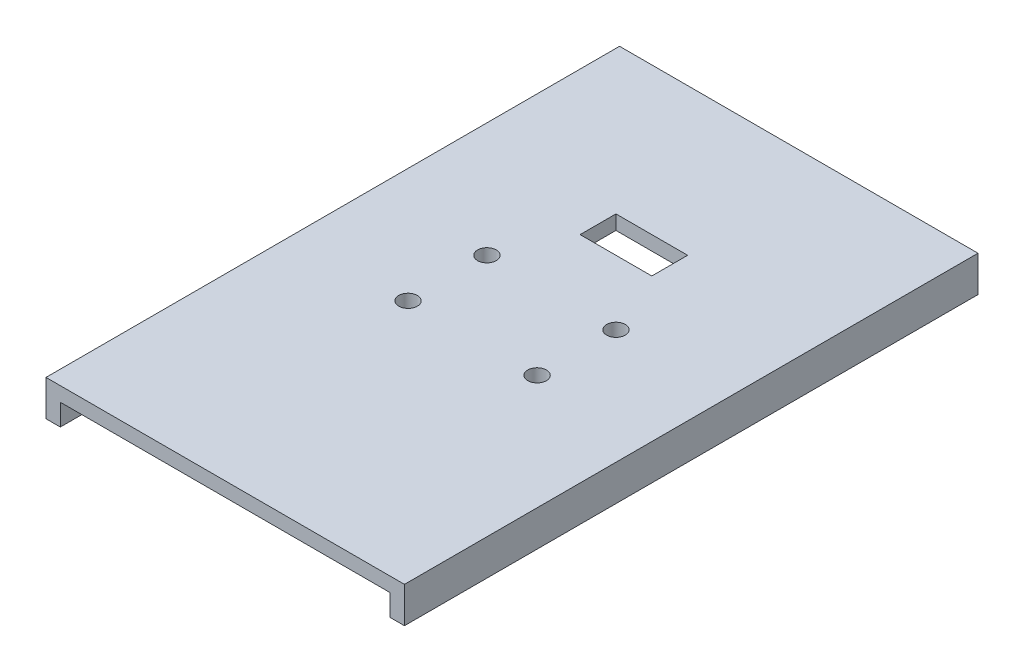
from build123d import *

# Parameters (mm, degrees)
SKETCH1_W           = 40
SKETCH1_H           = 80
BOSS_EXTRUDE1_DEPTH = 2
BOSS_EXTRUDE2_DEPTH = 80
SKETCH3_R           = 1.3
SKETCH3_W           = 10
SKETCH3_H           = 5
CUT_EXTRUDE1_DEPTH  = 2


with BuildPart() as part:
    # Sketch1 → Boss-Extrude1 (new body)
    with BuildSketch(Plane(origin=(0, 0, 0), x_dir=(1, 0, 0), z_dir=(0, 1, 0))):
        with Locations((20, 40)):
            Rectangle(SKETCH1_W, SKETCH1_H)
    extrude(amount=BOSS_EXTRUDE1_DEPTH)

    # Sketch2 → Boss-Extrude2 (add)
    with BuildSketch(Plane.XY):
        Polygon((0, 2), (-5, 2), (-5, -3), (-3, -3), (-3, 0), (0, 0), align=None)
        Polygon((43, 0), (40, 0), (40, 2), (45, 2), (45, -3), (43, -3), align=None)
    extrude(amount=-BOSS_EXTRUDE2_DEPTH)

    # Sketch3 → Cut-Extrude1 (cut)
    with BuildSketch(Plane(origin=(0, 2, 0), x_dir=(1, 0, 0), z_dir=(0, 1, 0))):
        with Locations(Location((11, 45.5, 0), (0, 0, 270))):
            Circle(SKETCH3_R)
        with Locations(Location((11, 34.5, 0), (0, 0, 270))):
            Circle(SKETCH3_R)
        with Locations(Location((29, 45.5, 0), (0, 0, 90))):
            Circle(SKETCH3_R)
        with Locations(Location((29, 34.5, 0), (0, 0, 90))):
            Circle(SKETCH3_R)
        with Locations((20, 57)):
            Rectangle(SKETCH3_W, SKETCH3_H)
    extrude(amount=-CUT_EXTRUDE1_DEPTH, mode=Mode.SUBTRACT)


solid = part.part
